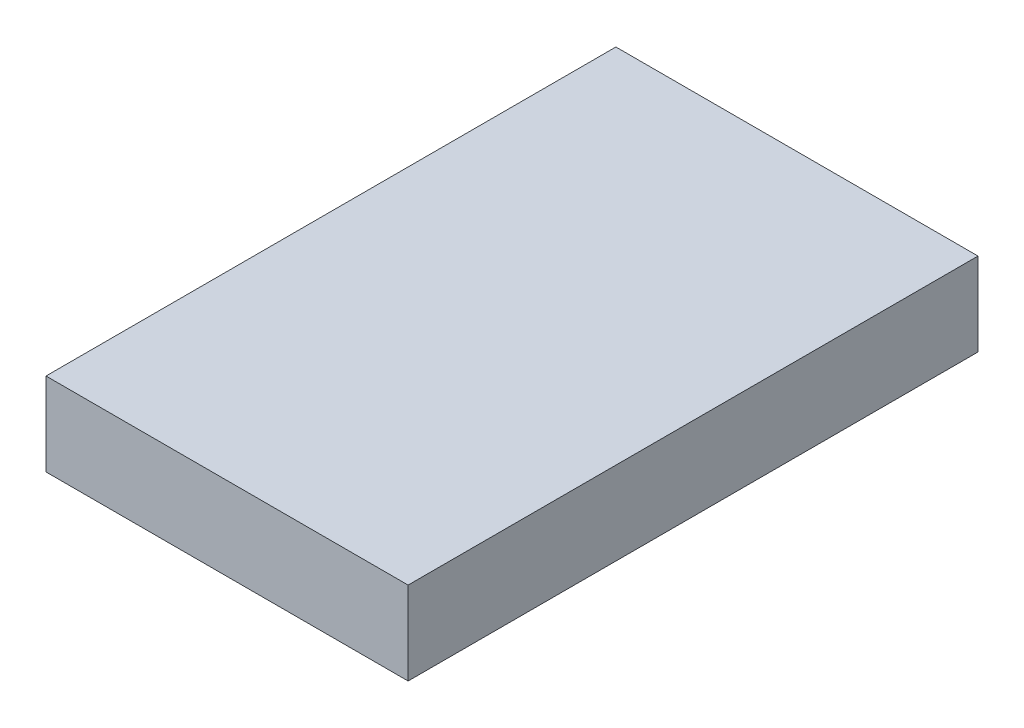
from build123d import *

# Parameters (mm, degrees)
SKETCH1_W           = 387.35
SKETCH1_H           = 609.6
BOSS_EXTRUDE1_DEPTH = 88.9


with BuildPart() as part:
    # Sketch1 → Boss-Extrude1 (new body)
    with BuildSketch(Plane(origin=(0, 0, 0), x_dir=(1, 0, 0), z_dir=(0, 1, 0))):
        Rectangle(SKETCH1_W, SKETCH1_H)
    extrude(amount=BOSS_EXTRUDE1_DEPTH)


solid = part.part
